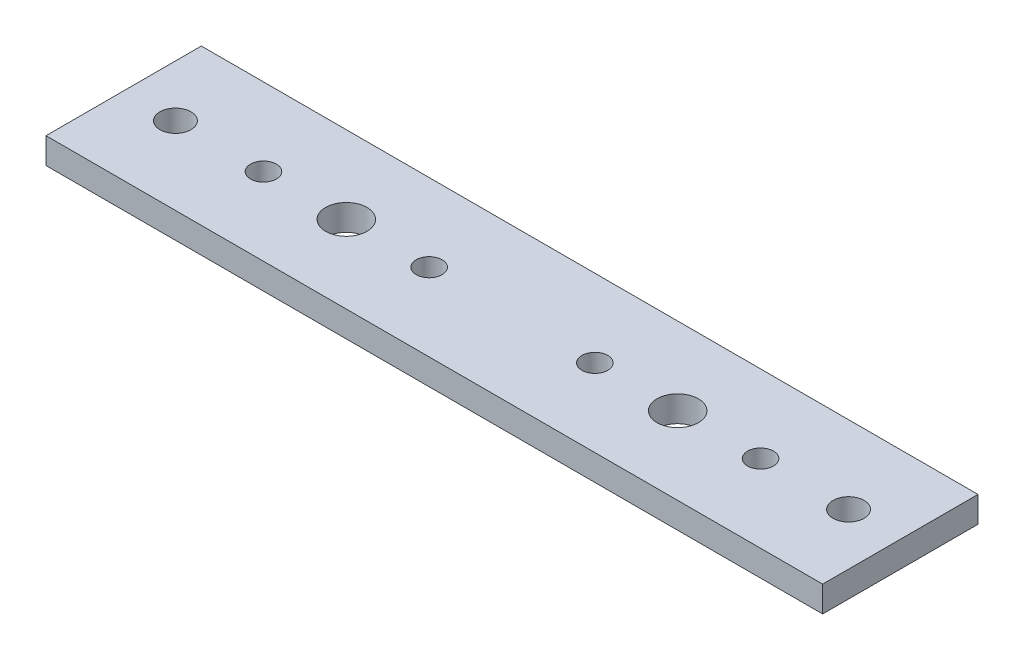
from build123d import *

# Parameters (mm, degrees)
SKETCH1_W           = 150
SKETCH1_H           = 30
SKETCH1_R           = 3
SKETCH1_R_2         = 4
SKETCH1_R_3         = 2.5
BOSS_EXTRUDE1_DEPTH = 5


with BuildPart() as part:
    # Sketch1 → Boss-Extrude1 (new body)
    with BuildSketch(Plane(origin=(0, 0, 0), x_dir=(1, 0, 0), z_dir=(0, 1, 0))):
        with Locations((-18.931377556, 26.227128617)):
            Rectangle(SKETCH1_W, SKETCH1_H)
        with Locations(Location((-83.931377556, 26.227128617, 0), (0, 0, 270))):
            Circle(SKETCH1_R, mode=Mode.SUBTRACT)
        with Locations(Location((46.068622444, 26.227128617, 0), (0, 0, 90))):
            Circle(SKETCH1_R, mode=Mode.SUBTRACT)
        with Locations(Location((-50.931377556, 26.227128617, 0), (0, 0, 270))):
            Circle(SKETCH1_R_2, mode=Mode.SUBTRACT)
        with Locations(Location((-34.931377556, 26.227128617, 0), (0, 0, 270))):
            Circle(SKETCH1_R_3, mode=Mode.SUBTRACT)
        with Locations(Location((-66.931377556, 26.227128617, 0), (0, 0, 270))):
            Circle(SKETCH1_R_3, mode=Mode.SUBTRACT)
        with Locations(Location((-2.931377556, 26.227128617, 0), (0, 0, 90))):
            Circle(SKETCH1_R_3, mode=Mode.SUBTRACT)
        with Locations(Location((13.068622444, 26.227128617, 0), (0, 0, 90))):
            Circle(SKETCH1_R_2, mode=Mode.SUBTRACT)
        with Locations(Location((29.068622444, 26.227128617, 0), (0, 0, 90))):
            Circle(SKETCH1_R_3, mode=Mode.SUBTRACT)
    extrude(amount=BOSS_EXTRUDE1_DEPTH)


solid = part.part
